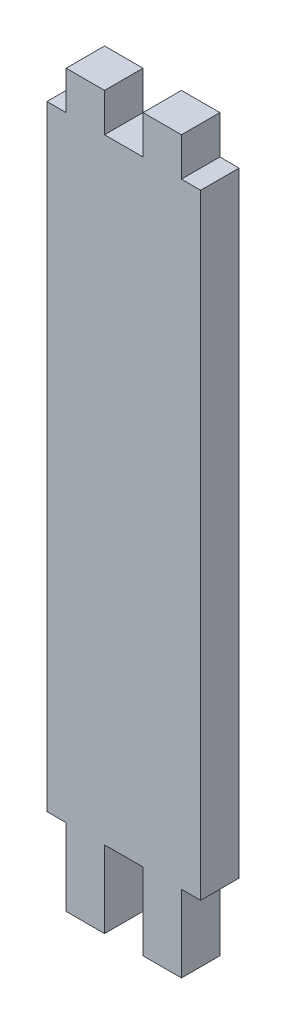
from build123d import *

# Parameters (mm, degrees)
BOSS_EXTRUDE1_DEPTH = 5


with BuildPart() as part:
    # Sketch1 → Boss-Extrude1 (new body)
    with BuildSketch(Plane.XY):
        Polygon((-7.5, 40), (-7.5, 45), (-2.5, 45), (-2.5, 40), (2.5, 40), (2.5, 45), (7.5, 45), (7.5, 40), (10, 40), (10, -40), (7.5, -40), (7.5, -50), (2.5, -50), (2.5, -45), (2.5, -40), (-2.5, -40), (-2.5, -50), (-7.5, -50), (-7.5, -45), (-7.5, -40), (-10, -40), (-10, 40), align=None)
    extrude(amount=BOSS_EXTRUDE1_DEPTH)


solid = part.part
